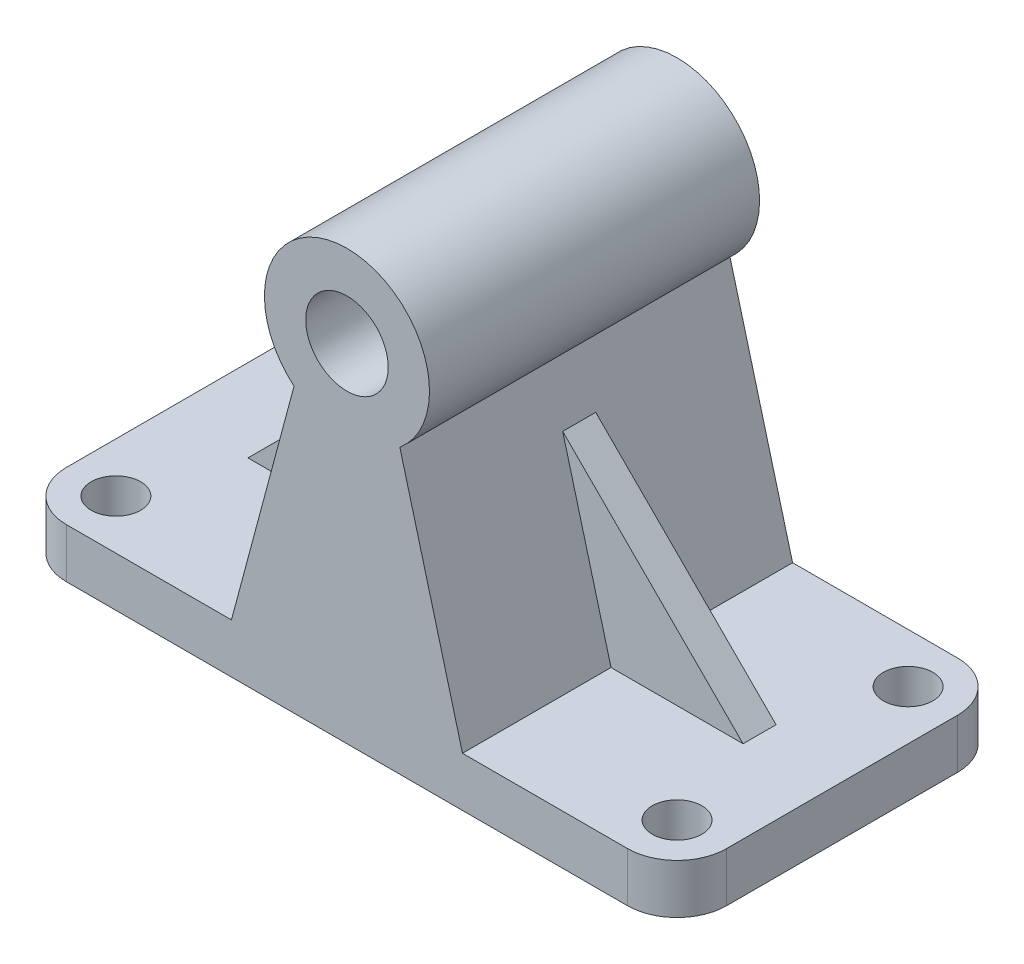
from build123d import *

# Parameters (mm, degrees)
SKETCH1_R           = 12.5
BOSS_EXTRUDE1_DEPTH = 50
FILLET1_R           = 15
SKETCH2_R           = 7.5
CUT_EXTRUDE1_DEPTH  = 161.390149323
RIB1_REACH          = 173.464
SKETCH3_WALL_W      = 422.202630092
SKETCH3_WALL_H      = 10


with BuildPart() as part:
    # Sketch1 → Boss-Extrude1 (new, symmetric)
    with BuildSketch(Plane.XY):
        with BuildLine():
            Line((-35, 15), (-16.025916537, 85.81224351))
            ThreePointArc((-16.025916537, 85.81224351), (0, 130), (16.025916537, 85.81224351))
            Line((16.025916537, 85.81224351), (35, 15))
            Line((35, 15), (100, 15))
            Line((100, 15), (100, 0))
            Line((100, 0), (-100, 0))
            Line((-100, 0), (-100, 15))
            Line((-100, 15), (-35, 15))
        make_face()
        with Locations((0, 105)):
            Circle(SKETCH1_R, mode=Mode.SUBTRACT)
    extrude(amount=BOSS_EXTRUDE1_DEPTH, both=True)

    # Fillet1
    fillet1_edges = [part.edges().sort_by_distance(p)[0] for p in [
        (100, 7.5, -50),
        (-100, 7.5, -50),
        (100, 7.5, 50),
        (-100, 7.5, 50),
    ]]
    fillet(fillet1_edges, radius=FILLET1_R)

    # Sketch2 → Cut-Extrude1 (cut, through all)
    with BuildSketch(Plane(origin=(0, 15, 0), x_dir=(1, 0, 0), z_dir=(0, 1, 0))):
        with Locations(Location((-85, 35, 0), (0, 0, 180))):
            Circle(SKETCH2_R)
        with Locations(Location((-85, -35, 0), (0, 0, 180))):
            Circle(SKETCH2_R)
        with Locations(Location((85, 35, 0), (0, 0, 180))):
            Circle(SKETCH2_R)
        with Locations(Location((85, -35, 0), (0, 0, 180))):
            Circle(SKETCH2_R)
    extrude(amount=-CUT_EXTRUDE1_DEPTH, mode=Mode.SUBTRACT)

    # Sketch3 wall → Rib1 (add, up to next)
    with BuildSketch(Plane(origin=(47.679491924, 42.320508076, 0), x_dir=(-0.707106781187, 0.707106781187, 0), z_dir=(-0.707106781187, -0.707106781187, 0)), mode=Mode.PRIVATE) as rib1_sk1:
        Rectangle(SKETCH3_WALL_W, SKETCH3_WALL_H)
    rib1_tool1 = extrude(rib1_sk1.sketch, amount=RIB1_REACH, mode=Mode.PRIVATE) - part.part
    rib1 = rib1_tool1.solids().sort_by_distance((47.679491924, 42.320508076, 0))[0]
    add(rib1)

    # Mirror1: Rib1 across plane
    add(rib1.mirror(Plane(origin=(0, 0, 0), x_dir=(0, 0, 1), z_dir=(1, 0, 0))))


solid = part.part
